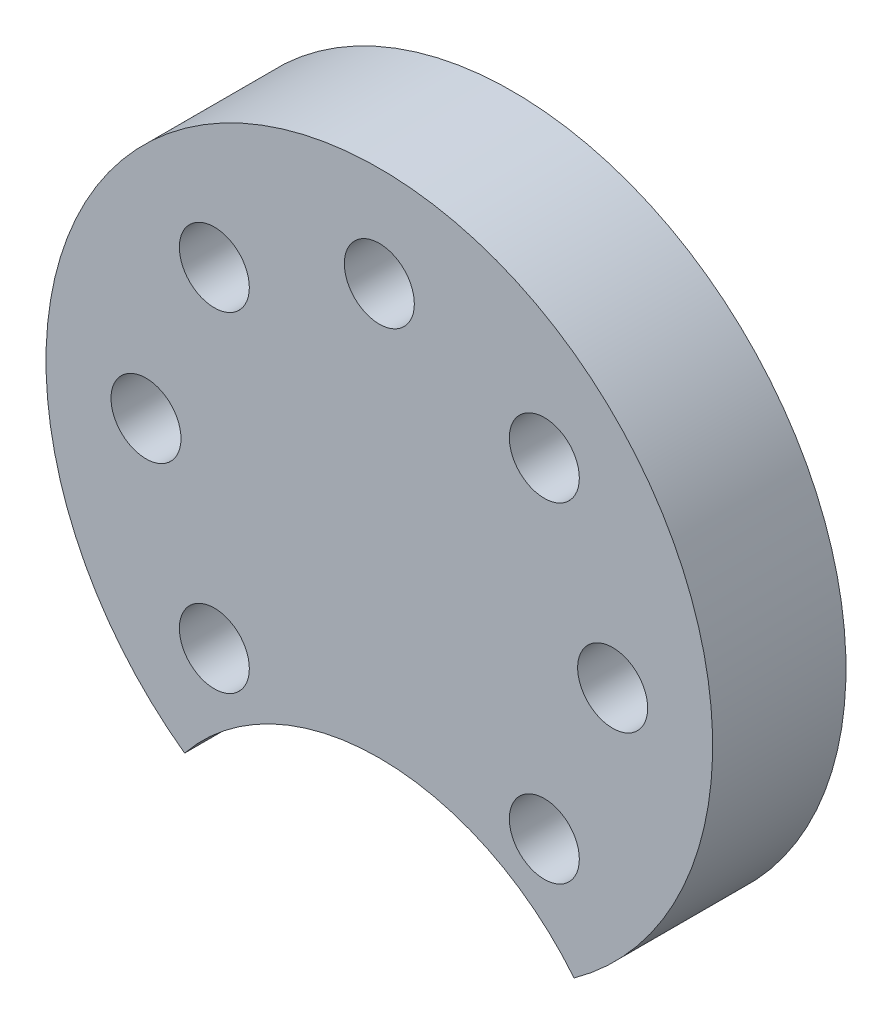
from build123d import *

# Parameters (mm, degrees)
SKETCH1_R           = 10
SKETCH1_R_2         = 1.05
SKETCH1_R_3         = 4
BOSS_EXTRUDE1_DEPTH = 4
SKETCH2_R           = 7.5
CUT_EXTRUDE1_DEPTH  = 10
BOSS_EXTRUDE2_START = -4
SKETCH3_R           = 4
BOSS_EXTRUDE2_DEPTH = 4


with BuildPart() as part:
    # Sketch1 → Boss-Extrude1 (new body)
    with BuildSketch(Plane.XY):
        Circle(SKETCH1_R)
        with Locations((-7, 0)):
            Circle(SKETCH1_R_2, mode=Mode.SUBTRACT)
        with Locations((0, 7)):
            Circle(SKETCH1_R_2, mode=Mode.SUBTRACT)
        with Locations((7, 0)):
            Circle(SKETCH1_R_2, mode=Mode.SUBTRACT)
        with Locations((4.949747468, 4.949747468)):
            Circle(SKETCH1_R_2, mode=Mode.SUBTRACT)
        with Locations((4.949747468, -4.949747468)):
            Circle(SKETCH1_R_2, mode=Mode.SUBTRACT)
        with Locations((0, -7)):
            Circle(SKETCH1_R_2, mode=Mode.SUBTRACT)
        with Locations((-4.949747468, -4.949747468)):
            Circle(SKETCH1_R_2, mode=Mode.SUBTRACT)
        with Locations((-4.949747468, 4.949747468)):
            Circle(SKETCH1_R_2, mode=Mode.SUBTRACT)
        Circle(SKETCH1_R_3, mode=Mode.SUBTRACT)
    extrude(amount=-BOSS_EXTRUDE1_DEPTH)

    # Sketch2 → Cut-Extrude1 (cut)
    with BuildSketch(Plane(origin=(0, 0, -4), x_dir=(-1, 0, 0), z_dir=(0, 0, -1))):
        with Locations((0, -12.82)):
            Circle(SKETCH2_R)
    extrude(amount=-CUT_EXTRUDE1_DEPTH, mode=Mode.SUBTRACT)

    # Sketch3 → Boss-Extrude2 (add)
    with BuildSketch(Plane(origin=(0, 0, -4), x_dir=(-1, 0, 0), z_dir=(0, 0, -1)).offset(BOSS_EXTRUDE2_START)):
        Circle(SKETCH3_R)
    extrude(amount=BOSS_EXTRUDE2_DEPTH)


solid = part.part
